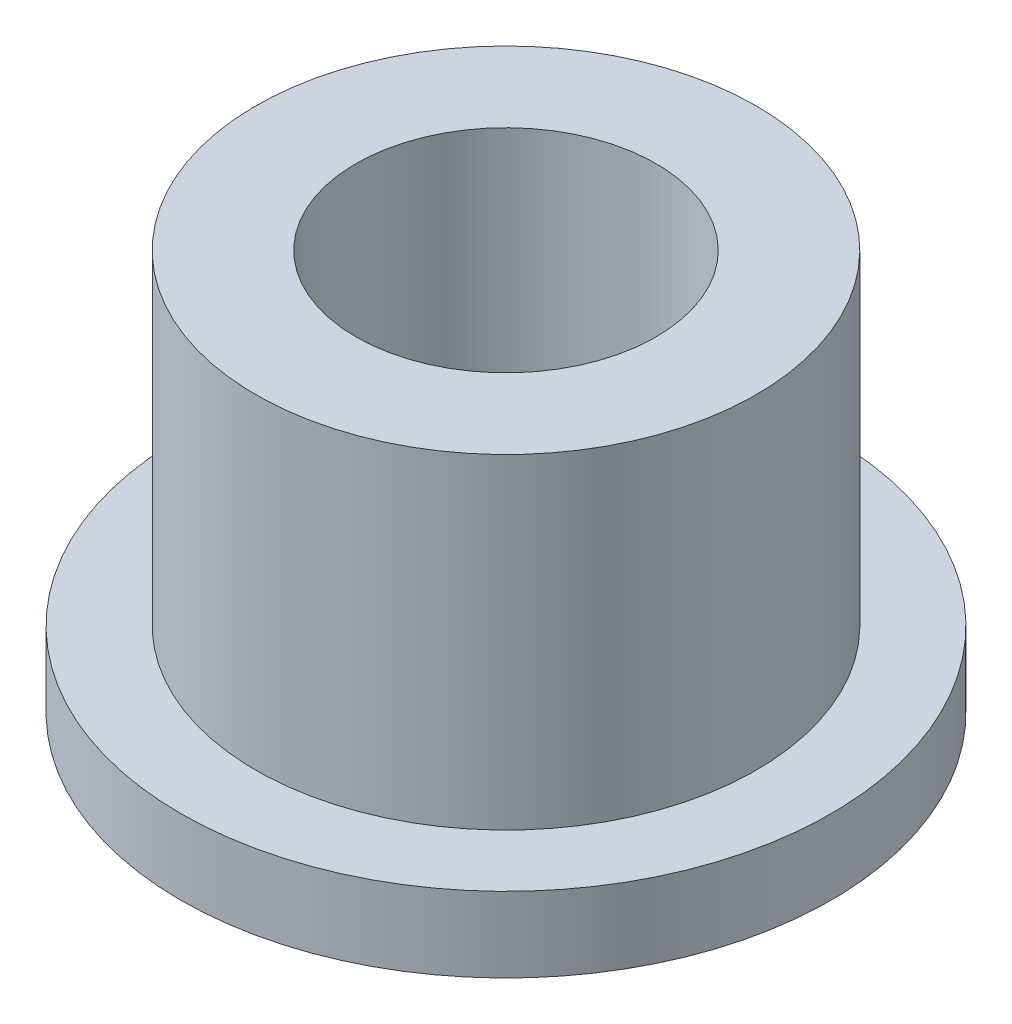
from build123d import *

# Parameters (mm, degrees)
SKETCH_1_R      = 13
SKETCH_1_R_2    = 6
EXTRUDE_1_DEPTH = 3
SKETCH_2_R      = 10
SKETCH_2_R_2    = 6
EXTRUDE_2_DEPTH = 13


with BuildPart() as part:
    # 草圖1 → 填料-伸長1 (new body)
    with BuildSketch(Plane(origin=(0, 0, 0), x_dir=(1, 0, 0), z_dir=(0, 1, 0))):
        with Locations(Location((0, 0, 0), (0, 0, 270))):
            Circle(SKETCH_1_R)
        with Locations(Location((0, 0, 0), (0, 0, 270))):
            Circle(SKETCH_1_R_2, mode=Mode.SUBTRACT)
    extrude(amount=EXTRUDE_1_DEPTH)

    # 草圖2 → 填料-伸長2 (add)
    with BuildSketch(Plane(origin=(0, 3, 0), x_dir=(1, 0, 0), z_dir=(0, 1, 0))):
        with Locations(Location((0, 0, 0), (0, 0, 90))):
            Circle(SKETCH_2_R)
        with Locations(Location((0, 0, 0), (0, 0, 270))):
            Circle(SKETCH_2_R_2, mode=Mode.SUBTRACT)
    extrude(amount=EXTRUDE_2_DEPTH)


solid = part.part
